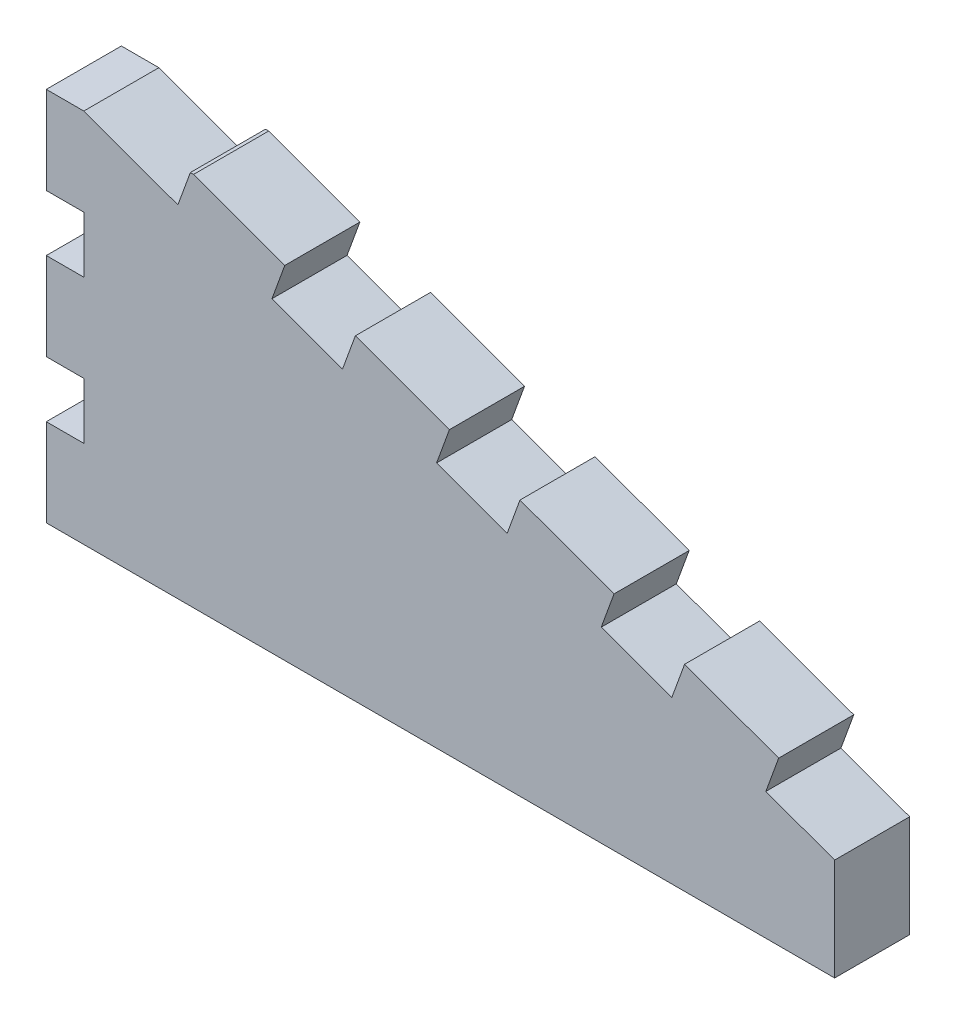
from build123d import *

# Parameters (mm, degrees)
BOSS_EXTRU_1_DEPTH = 6


with BuildPart() as part:
    # Esquisse1 → Boss.-Extru.1 (new body)
    with BuildSketch(Plane.XY):
        Polygon((-52.482459034, 27.263838853), (-60, 30), (-63, 30), (-63, 23), (-60, 23), (-60, 18.5), (-63, 18.5), (-63, 11.5), (-60, 11.5), (-60, 7), (-63, 7), (-63, 0), (0, 0), (0, 8.161785944), (-5.497827994, 10.162831687), (-4.471767564, 12.981909549), (-11.989308531, 15.718070696), (-13.015368961, 12.898992834), (-18.653524685, 14.951113694), (-17.627464255, 17.770191556), (-25.145005222, 20.506352703), (-26.171065652, 17.68727484), (-31.809221376, 19.7393957), (-30.783160946, 22.558473563), (-38.300701913, 25.294634709), (-39.326762343, 22.475556847), (-44.964918067, 24.527677707), (-43.938857637, 27.346755569), (-51.2285868, 30), (-51.48657782, 30), align=None)
    extrude(amount=BOSS_EXTRU_1_DEPTH)


solid = part.part
